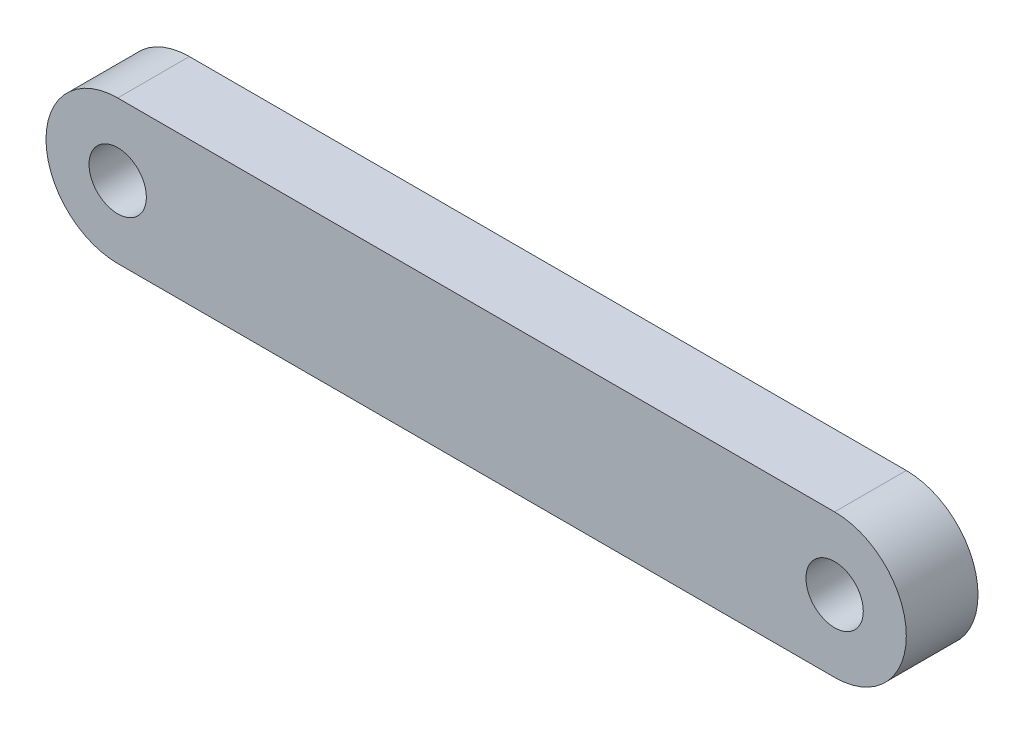
from build123d import *

# Parameters (mm, degrees)
ESQUISSE1_R        = 2
BOSS_EXTRU_1_DEPTH = 5


with BuildPart() as part:
    # Esquisse1 → Boss.-Extru.1 (new body)
    with BuildSketch(Plane.XY):
        with BuildLine():
            Line((0, 5), (50, 5))
            ThreePointArc((50, 5), (55, 0), (50, -5))
            Line((50, -5), (0, -5))
            ThreePointArc((0, -5), (-5, 0), (0, 5))
        make_face()
        Circle(ESQUISSE1_R, mode=Mode.SUBTRACT)
        with Locations((50, 0)):
            Circle(ESQUISSE1_R, mode=Mode.SUBTRACT)
    extrude(amount=BOSS_EXTRU_1_DEPTH)


solid = part.part
